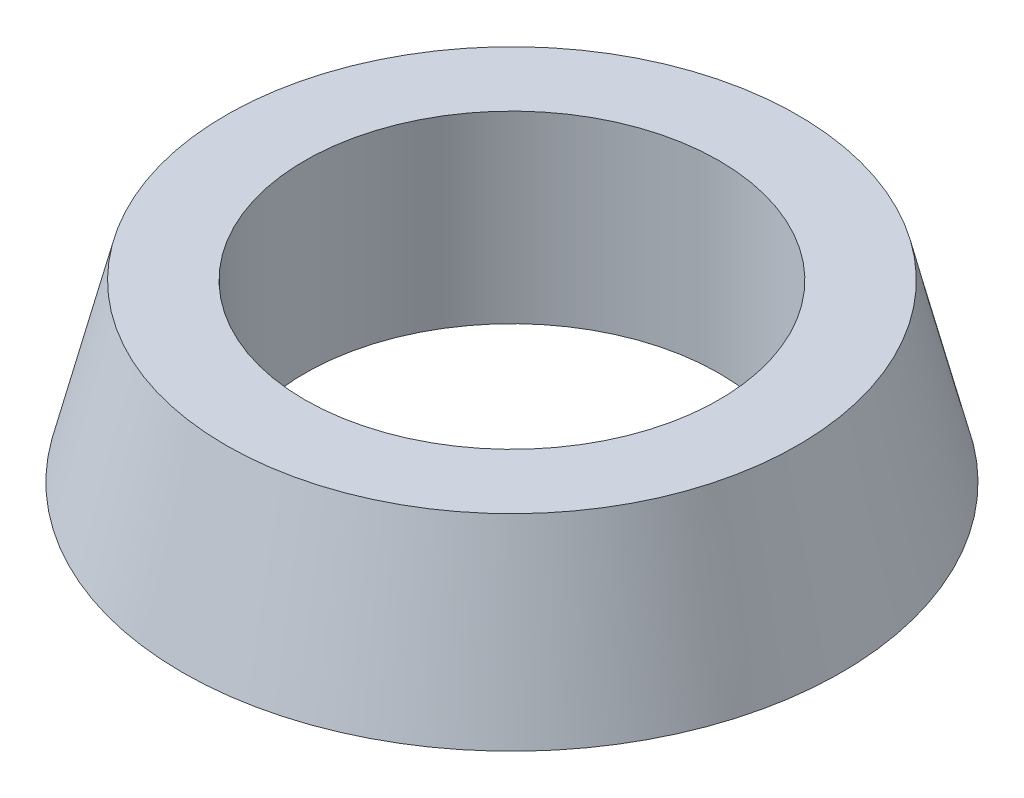
from build123d import *


with BuildPart() as part:
    # Sketch1 → Revolve1 (revolve)
    with BuildSketch(Plane.XY, mode=Mode.PRIVATE) as revolve1_sk:
        Polygon((22.5, 0.06528296), (22.5, 20.06528296), (31.062767946, 20.06528296), (35.8, 1.06528296), (30.3, 1.06528296), (30.3, 0.06528296), align=None)
    revolve(revolve1_sk.sketch.rotate(Axis((0, 0, 0), (0, -1, 0)), 90), axis=Axis((0, 0, 0), (0, -1, 0)))


solid = part.part
